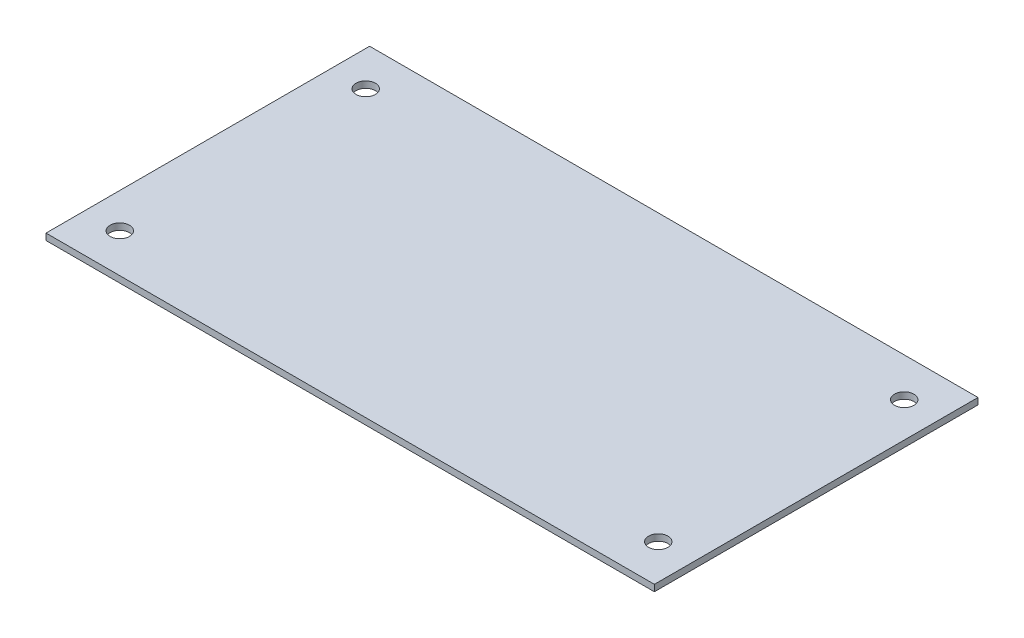
from build123d import *

# Parameters (mm, degrees)
ESQUISSE1_W        = 94
ESQUISSE1_H        = 50
ESQUISSE1_R        = 1.5
BOSS_EXTRU_1_DEPTH = 1


with BuildPart() as part:
    # Esquisse1 → Boss.-Extru.1 (new body)
    with BuildSketch(Plane(origin=(0, 0, 0), x_dir=(1, 0, 0), z_dir=(0, 1, 0))):
        Rectangle(ESQUISSE1_W, ESQUISSE1_H)
        with Locations(Location((-41.6, 19, 0), (0, 0, 270))):
            Circle(ESQUISSE1_R, mode=Mode.SUBTRACT)
        with Locations(Location((41.6, 19, 0), (0, 0, 90))):
            Circle(ESQUISSE1_R, mode=Mode.SUBTRACT)
        with Locations(Location((41.6, -19, 0), (0, 0, 270))):
            Circle(ESQUISSE1_R, mode=Mode.SUBTRACT)
        with Locations(Location((-41.6, -19, 0), (0, 0, 90))):
            Circle(ESQUISSE1_R, mode=Mode.SUBTRACT)
    extrude(amount=BOSS_EXTRU_1_DEPTH)


solid = part.part
